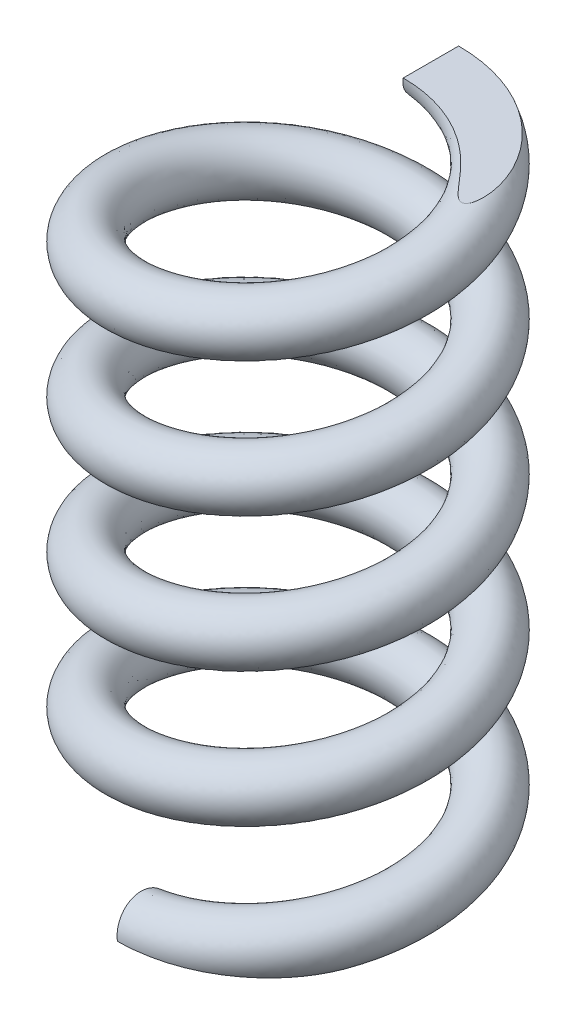
from build123d import *

# Parameters (mm, degrees)
SWEEP1_PITCH       = 18.666666667
SWEEP1_HEIGHT      = 84
SWEEP1_RADIUS      = 19.85
SKETCH4_R          = 3.85
SKETCH5_R          = 41.506662124
CUT_EXTRUDE1_DEPTH = 10
SKETCH6_R          = 43.039357924
CUT_EXTRUDE2_DEPTH = 10


with BuildPart() as part:
    # Sweep1: sweep along a helix
    with BuildLine() as sweep1_path:
        Helix(SWEEP1_PITCH, SWEEP1_HEIGHT, SWEEP1_RADIUS, center=(0, 0, 0), direction=(0, 1, 0))
    # Sketch4 → Sweep1 (sweep)
    with BuildSketch(Plane(origin=(0, 0, 19.85), x_dir=(0, 0, -1), z_dir=(0.9889845962348189, 0.14801847320605796, 0))):
        Circle(SKETCH4_R)
    sweep(path=sweep1_path.line, is_frenet=True)

    # Sketch5 → Cut-Extrude1 (cut)
    with BuildSketch(Plane(origin=(0, 0, 0), x_dir=(1, 0, 0), z_dir=(0, 1, 0))):
        Circle(SKETCH5_R)
    extrude(amount=-CUT_EXTRUDE1_DEPTH, mode=Mode.SUBTRACT)

    # Sketch6 → Cut-Extrude2 (cut)
    with BuildSketch(Plane(origin=(0, 84, 0), x_dir=(-1, 0, 0), z_dir=(0, 1, 0))):
        Circle(SKETCH6_R)
    extrude(amount=CUT_EXTRUDE2_DEPTH, mode=Mode.SUBTRACT)


solid = part.part
